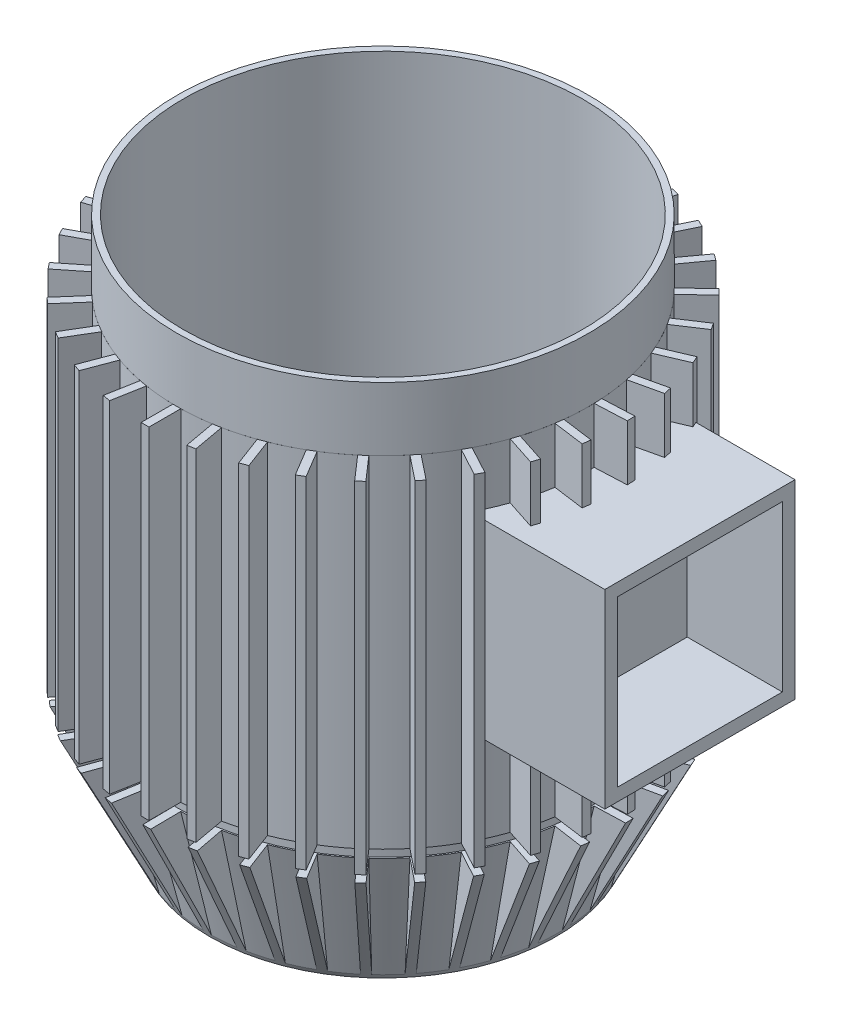
from build123d import *

# Parameters (mm, degrees)
SKETCH1_R           = 65
BOSS_EXTRUDE1_DEPTH = 170
CHAMFER1_SIZE       = 10
CHAMFER1_SIZE2      = 40
SHELL1_T            = -2
BOSS_EXTRUDE2_REACH = 231.619
SKETCH2_W           = 2.5
SKETCH2_H           = 170
CIRPATTERN1_COUNT   = 35
SKETCH4_R           = 10
CUT_EXTRUDE1_DEPTH  = 201.367373921
BOSS_EXTRUDE3_REACH = 257.232
SKETCH5_W           = 60
SKETCH5_H           = 60
SKETCH6_W           = 52
SKETCH6_H           = 52
CUT_EXTRUDE2_DEPTH  = 30
SKETCH7_W           = 15.566705205
SKETCH7_H           = 20


with BuildPart() as part:
    # Sketch1 → Boss-Extrude1 (new body)
    with BuildSketch(Plane(origin=(0, 0, 0), x_dir=(1, 0, 0), z_dir=(0, 1, 0))):
        with Locations(Location((0, 0, 0), (0, 0, 270))):
            Circle(SKETCH1_R)
    extrude(amount=-BOSS_EXTRUDE1_DEPTH)

    # Chamfer1
    chamfer1_edges = [part.edges().sort_by_distance(p)[0] for p in [
        (0, -170, -65),
    ]]
    chamfer1_side = [part.faces().sort_by_distance(p)[0] for p in [
        (0, -170, 0),
    ]]
    chamfer(chamfer1_edges, length=CHAMFER1_SIZE, length2=CHAMFER1_SIZE2, reference=chamfer1_side[0])

    # Shell1
    shell1_openings = [part.faces().sort_by_distance(p)[0] for p in [
        (0, 0, 0),
    ]]
    offset(amount=SHELL1_T, openings=shell1_openings, kind=Kind.INTERSECTION)

    # Sketch2 → Boss-Extrude2 (add, up to next)
    with BuildSketch(Plane.XY.offset(75), mode=Mode.PRIVATE) as boss_extrude2_sk1:
        with Locations((0, -85)):
            Rectangle(SKETCH2_W, SKETCH2_H)
    boss_extrude2_tool1 = extrude(boss_extrude2_sk1.sketch, amount=-BOSS_EXTRUDE2_REACH, mode=Mode.PRIVATE) - part.part
    boss_extrude2 = boss_extrude2_tool1.solids().sort_by_distance((0, -85, 75))[0]
    add(boss_extrude2)

    # CirPattern1: Boss-Extrude2 ×35 about axis
    cirpattern1_axis = Axis((0, 0, 0), (0, 1, 0))
    for i in range(1, CIRPATTERN1_COUNT):
        add(boss_extrude2.rotate(cirpattern1_axis, i * 360 / CIRPATTERN1_COUNT))

    # Sketch3 → Cut-Revolve1 (revolve, cut)
    with BuildSketch(Plane.XY, mode=Mode.PRIVATE) as cut_revolve1_sk:
        Polygon((54.65595067, -170), (74.489023715, -130.119386817), (64.567614542, -130), (64.567614542, -127.5), (90.450979811, -127.5), (90.450979811, -179.278387236), align=None)
    revolve(cut_revolve1_sk.sketch.rotate(Axis((0, 0, 0), (0, -1, 0)), 90), axis=Axis((0, 0, 0), (0, -1, 0)), mode=Mode.SUBTRACT)

    # Sketch4 → Cut-Extrude1 (cut, through all)
    with BuildSketch(Plane.XZ.offset(170)):
        with Locations(Location((0, 0, 0), (0, 0, 270))):
            Circle(SKETCH4_R)
    extrude(amount=-CUT_EXTRUDE1_DEPTH, mode=Mode.SUBTRACT)

    # Sketch5 → Boss-Extrude3 (add, up to next)
    with BuildSketch(Plane(origin=(100, 0, 0), x_dir=(0, 0, -1), z_dir=(1, 0, 0)), mode=Mode.PRIVATE) as boss_extrude3_sk1:
        with Locations((0, -67.5)):
            Rectangle(SKETCH5_W, SKETCH5_H)
    boss_extrude3_tool1 = extrude(boss_extrude3_sk1.sketch, amount=-BOSS_EXTRUDE3_REACH, mode=Mode.PRIVATE) - part.part
    add(boss_extrude3_tool1.solids().sort_by_distance((100, -67.5, 0))[0])

    # Sketch6 → Cut-Extrude2 (cut)
    with BuildSketch(Plane(origin=(100, 0, 0), x_dir=(0, 0, -1), z_dir=(1, 0, 0))):
        with Locations((0, -67.5)):
            Rectangle(SKETCH6_W, SKETCH6_H)
    extrude(amount=-CUT_EXTRUDE2_DEPTH, mode=Mode.SUBTRACT)

    # Sketch7 → Cut-Revolve2 (revolve, cut)
    with BuildSketch(Plane(origin=(0, 0, 0), x_dir=(0, 0, -1), z_dir=(1, 0, 0)), mode=Mode.PRIVATE) as cut_revolve2_sk:
        with Locations((-72.771332261, -10)):
            Rectangle(SKETCH7_W, SKETCH7_H)
    revolve(cut_revolve2_sk.sketch.rotate(Axis((0, 35.754785945, 0), (0, -1, 0)), 184.040925316), axis=Axis((0, 35.754785945, 0), (0, -1, 0)), mode=Mode.SUBTRACT)


solid = part.part
